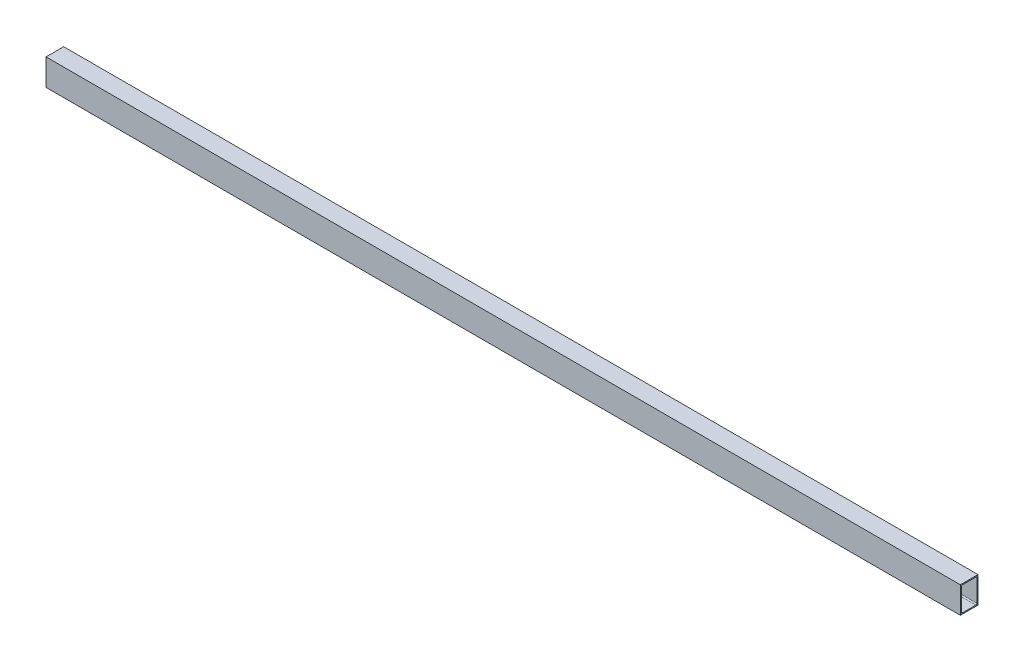
from build123d import *

# Parameters (mm, degrees)
SKETCH1_W           = 101.6
SKETCH1_H           = 152.4
BOSS_EXTRUDE1_DEPTH = 5265.200001456


with BuildPart() as part:
    # Sketch1 → Boss-Extrude1 (new body)
    with BuildSketch(Plane(origin=(0, 0, 0), x_dir=(0, 0, -1), z_dir=(1, 0, 0))):
        with Locations((-50.8, 76.2)):
            Rectangle(SKETCH1_W, SKETCH1_H)
        with BuildLine():
            Line((-95.25, 12.7), (-95.25, 139.7))
            ThreePointArc((-95.25, 139.7), (-93.390128061, 144.190128061), (-88.9, 146.05))
            Line((-88.9, 146.05), (-12.7, 146.05))
            ThreePointArc((-12.7, 146.05), (-8.209871939, 144.190128061), (-6.35, 139.7))
            Line((-6.35, 139.7), (-6.35, 12.7))
            ThreePointArc((-6.35, 12.7), (-8.209871939, 8.209871939), (-12.7, 6.35))
            Line((-12.7, 6.35), (-88.9, 6.35))
            ThreePointArc((-88.9, 6.35), (-93.390128061, 8.209871939), (-95.25, 12.7))
        make_face(mode=Mode.SUBTRACT)
    extrude(amount=BOSS_EXTRUDE1_DEPTH)


solid = part.part
